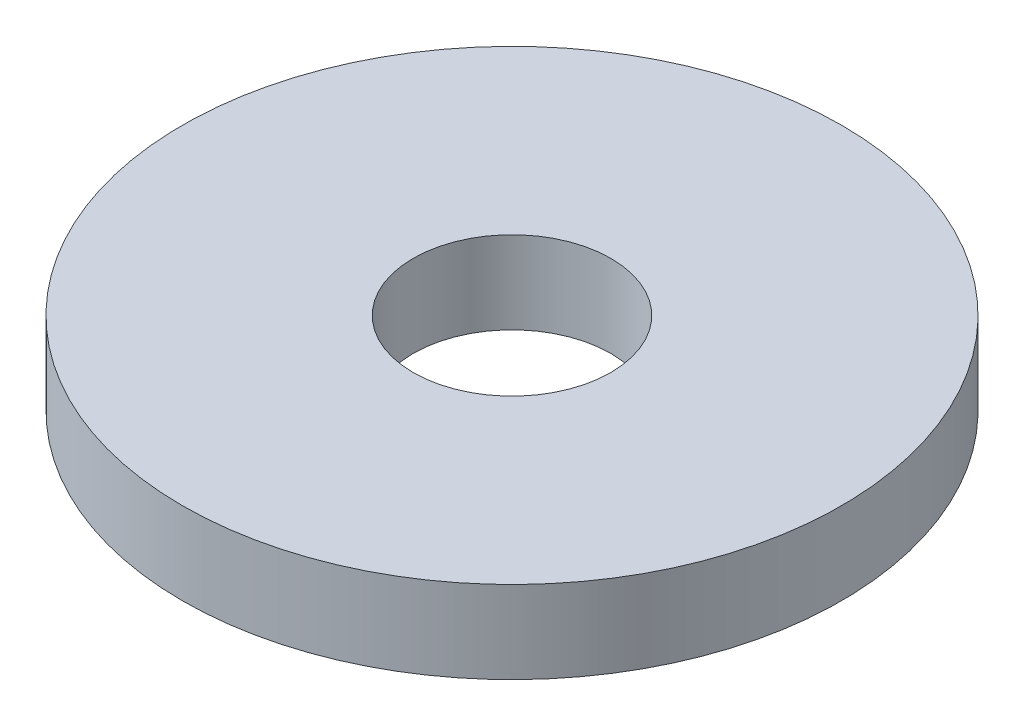
from build123d import *

# Parameters (mm, degrees)
SKETCH1_R            = 4
BOSS_EXTRUDE1_DEPTH  = 1
M2_CLEARANCE_HOLE1_D = 2.4


with BuildPart() as part:
    # Sketch1 → Boss-Extrude1 (new body)
    with BuildSketch(Plane(origin=(0, 0, 0), x_dir=(1, 0, 0), z_dir=(0, 1, 0))):
        with Locations(Location((0, 0, 0), (0, 0, 270))):
            Circle(SKETCH1_R)
    extrude(amount=BOSS_EXTRUDE1_DEPTH)

    # M2 Clearance Hole1 (through all)
    with Locations(Plane(origin=(0, 1, 0), x_dir=(1, 0, 0), z_dir=(0, 1, 0))):
        with Locations((0, 0)):
            Hole(M2_CLEARANCE_HOLE1_D / 2)


solid = part.part
